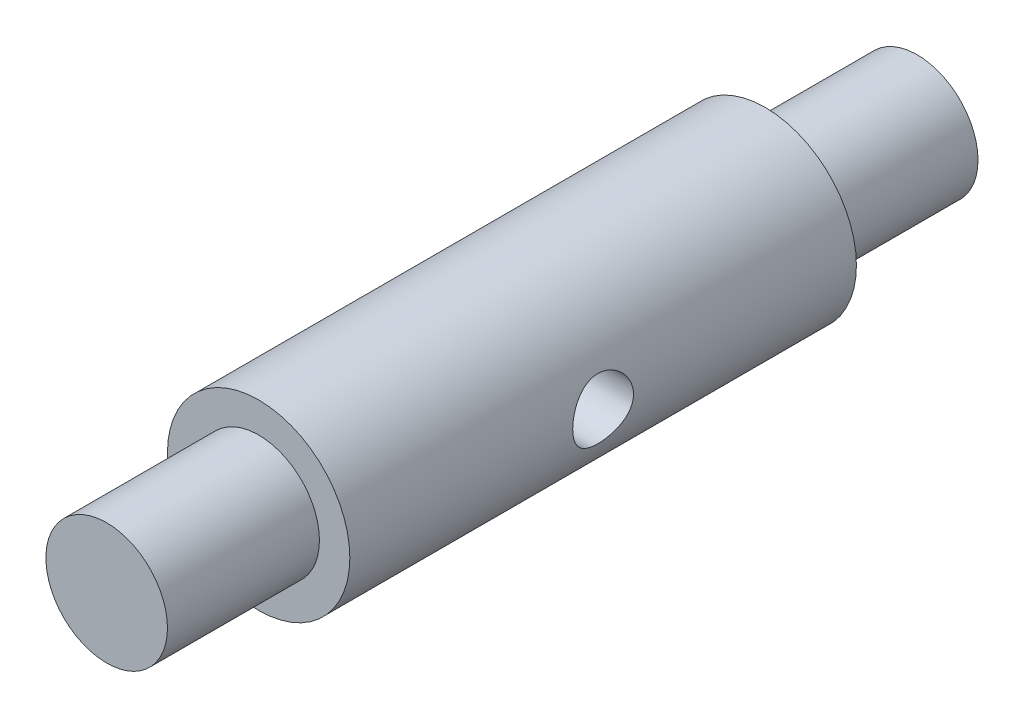
from build123d import *

# Parameters (mm, degrees)
SKETCH1_R               = 9
BOSS_EXTRUDE1_DEPTH     = 25
SKETCH2_R               = 6
BOSS_EXTRUDE2_DEPTH     = 40
CUT_EXTRUDE2_DEPTH      = 42.976183724
CUT_EXTRUDE2_DEPTH_BACK = 42.976183724
SKETCH3_R               = 3


with BuildPart() as part:
    # Sketch1 → Boss-Extrude1 (new, symmetric)
    with BuildSketch(Plane.XY):
        Circle(SKETCH1_R)
    extrude(amount=BOSS_EXTRUDE1_DEPTH, both=True)

    # Sketch2 → Boss-Extrude2 (add, symmetric)
    with BuildSketch(Plane.XY):
        Circle(SKETCH2_R)
    extrude(amount=BOSS_EXTRUDE2_DEPTH, both=True)

    # Sketch3 → Cut-Extrude2 (cut, two sides: drawn at the far end of the back side and taken through both)
    with BuildSketch(Plane(origin=(0, 0, 0), x_dir=(0, 0, -1), z_dir=(1, 0, 0)).offset(-CUT_EXTRUDE2_DEPTH_BACK)):
        Circle(SKETCH3_R)
    extrude(amount=CUT_EXTRUDE2_DEPTH + CUT_EXTRUDE2_DEPTH_BACK, mode=Mode.SUBTRACT)


solid = part.part
